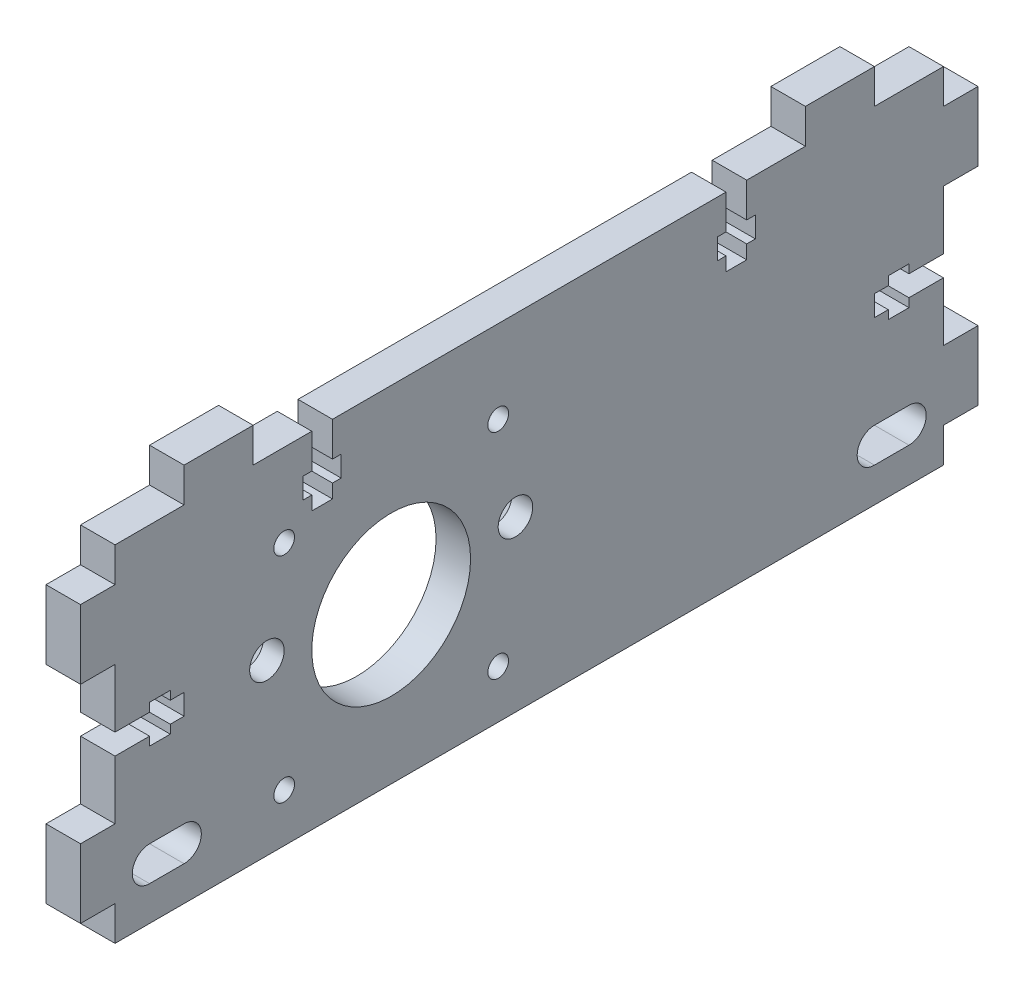
from build123d import *

# Parameters (mm, degrees)
SKETCH1_W           = 120
SKETCH1_H           = 50
SKETCH1_R           = 1.5
SKETCH1_R_2         = 11.5
SKETCH1_R_3         = 2.5
BOSS_EXTRUDE1_DEPTH = 5
CHAMFER1_SIZE       = 2
SKETCH2_W           = 5
SKETCH2_H           = 10
SKETCH2_W_2         = 10
SKETCH2_H_2         = 5
BOSS_EXTRUDE2_DEPTH = 5
CUT_EXTRUDE1_DEPTH  = 137.656503687


with BuildPart() as part:
    # Sketch1 → Boss-Extrude1 (new body)
    with BuildSketch(Plane(origin=(0, 0, 0), x_dir=(0, 0, -1), z_dir=(1, 0, 0))):
        with Locations((-60, 25)):
            Rectangle(SKETCH1_W, SKETCH1_H)
        with Locations((-95.5, 38)):
            Circle(SKETCH1_R, mode=Mode.SUBTRACT)
        with Locations((-64.5, 38)):
            Circle(SKETCH1_R, mode=Mode.SUBTRACT)
        with Locations((-64.5, 7)):
            Circle(SKETCH1_R, mode=Mode.SUBTRACT)
        with Locations((-95.5, 7)):
            Circle(SKETCH1_R, mode=Mode.SUBTRACT)
        with Locations((-80, 22.5)):
            Circle(SKETCH1_R_2, mode=Mode.SUBTRACT)
        with Locations((-98, 24.5)):
            Circle(SKETCH1_R_3, mode=Mode.SUBTRACT)
        with Locations((-62, 24.5)):
            Circle(SKETCH1_R_3, mode=Mode.SUBTRACT)
    extrude(amount=BOSS_EXTRUDE1_DEPTH)

    # Chamfer1
    chamfer1_edges = [part.edges().sort_by_distance(p)[0] for p in [
        (0, 24.5, 100.5),
        (0, 24.5, 64.5),
    ]]
    chamfer(chamfer1_edges, length=CHAMFER1_SIZE)

    # Sketch2 → Boss-Extrude2 (add)
    with BuildSketch(Plane(origin=(5, 0, 0), x_dir=(0, 0, -1), z_dir=(1, 0, 0))):
        with Locations((-122.5, 10)):
            Rectangle(SKETCH2_W, SKETCH2_H)
        with Locations((-122.5, 40)):
            Rectangle(SKETCH2_W, SKETCH2_H)
        with Locations((-105, 52.5)):
            Rectangle(SKETCH2_W_2, SKETCH2_H_2)
        with Locations((-15, 52.5)):
            Rectangle(SKETCH2_W_2, SKETCH2_H_2)
        with Locations((2.5, 40)):
            Rectangle(SKETCH2_W, SKETCH2_H)
        with Locations((2.5, 10)):
            Rectangle(SKETCH2_W, SKETCH2_H)
    extrude(amount=-BOSS_EXTRUDE2_DEPTH)

    # Sketch3 → Cut-Extrude1 (cut, through all)
    with BuildSketch(Plane(origin=(5, 0, 0), x_dir=(0, 0, -1), z_dir=(1, 0, 0))):
        Polygon((0, 26.5), (-5, 26.5), (-5, 27.75), (-8, 27.75), (-8, 26.5), (-10, 26.5), (-10, 23.5), (-8, 23.5), (-8, 22.25), (-5, 22.25), (-5, 23.5), (0, 23.5), align=None)
        Polygon((-120, 23.5), (-120, 26.5), (-115, 26.5), (-115, 27.75), (-112, 27.75), (-112, 26.5), (-110, 26.5), (-110, 23.5), (-112, 23.5), (-112, 22.25), (-115, 22.25), (-115, 23.5), align=None)
        Polygon((-31.5, 50), (-31.5, 45), (-32.75, 45), (-32.75, 42), (-31.5, 42), (-31.5, 40), (-28.5, 40), (-28.5, 42), (-27.25, 42), (-27.25, 45), (-28.5, 45), (-28.5, 50), align=None)
        Polygon((-91.5, 50), (-88.5, 50), (-88.5, 45), (-87.25, 45), (-87.25, 42), (-88.5, 42), (-88.5, 40), (-91.5, 40), (-91.5, 42), (-92.75, 42), (-92.75, 45), (-91.5, 45), align=None)
        with BuildLine():
            Line((-115, 10), (-110, 10))
            ThreePointArc((-110, 10), (-107.5, 7.5), (-110, 5))
            Line((-110, 5), (-115, 5))
            ThreePointArc((-115, 5), (-117.5, 7.5), (-115, 10))
        make_face()
        with BuildLine():
            Line((-5, 10), (-10, 10))
            ThreePointArc((-10, 10), (-12.5, 7.5), (-10, 5))
            Line((-10, 5), (-5, 5))
            ThreePointArc((-5, 5), (-2.5, 7.5), (-5, 10))
        make_face()
    extrude(amount=-CUT_EXTRUDE1_DEPTH, mode=Mode.SUBTRACT)


solid = part.part
